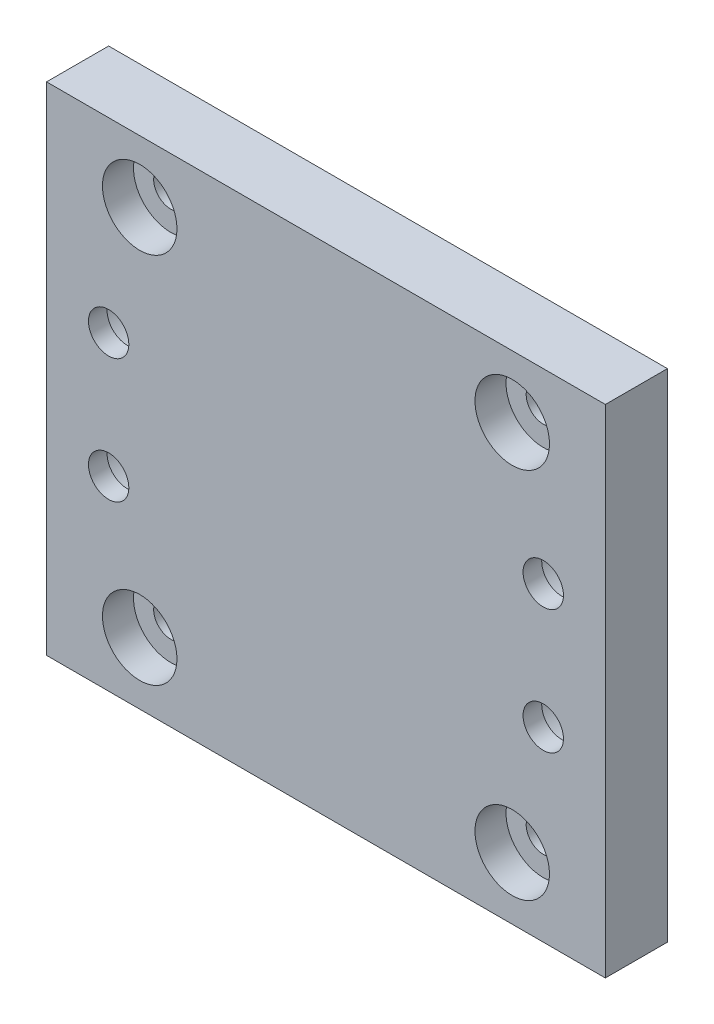
from build123d import *

# Parameters (mm, degrees)
ESQUISSE1_W             = 90
ESQUISSE1_H             = 80
ESQUISSE1_R             = 2.75
ESQUISSE1_R_2           = 3.25
BOSS_EXTRU_1_DEPTH      = 10
ESQUISSE2_R             = 6
ENL_V_MAT_EXTRU_1_DEPTH = 5
ESQUISSE4_R             = 7
ENL_V_MAT_EXTRU_2_DEPTH = 7


with BuildPart() as part:
    # Esquisse1 → Boss.-Extru.1 (new body)
    with BuildSketch(Plane.XY):
        with Locations((-2.432799292, 6.788403994)):
            Rectangle(ESQUISSE1_W, ESQUISSE1_H)
        with Locations((-32.432799292, 36.788403994)):
            Circle(ESQUISSE1_R, mode=Mode.SUBTRACT)
        with Locations((27.567200708, 36.788403994)):
            Circle(ESQUISSE1_R, mode=Mode.SUBTRACT)
        with Locations((27.567200708, -23.211596006)):
            Circle(ESQUISSE1_R, mode=Mode.SUBTRACT)
        with Locations((-32.432799292, -23.211596006)):
            Circle(ESQUISSE1_R, mode=Mode.SUBTRACT)
        with Locations((-37.432799292, 16.788403994)):
            Circle(ESQUISSE1_R_2, mode=Mode.SUBTRACT)
        with Locations((-37.432799292, -3.211596006)):
            Circle(ESQUISSE1_R_2, mode=Mode.SUBTRACT)
        with Locations((32.567200708, 16.788403994)):
            Circle(ESQUISSE1_R_2, mode=Mode.SUBTRACT)
        with Locations((32.567200708, -3.211596006)):
            Circle(ESQUISSE1_R_2, mode=Mode.SUBTRACT)
    extrude(amount=BOSS_EXTRU_1_DEPTH)

    # Esquisse2 → Enlèv. mat.-Extru.1 (cut)
    with BuildSketch(Plane.XY.offset(10)):
        with Locations((-32.432799292, 36.788403994)):
            Circle(ESQUISSE2_R)
        with Locations((27.567200708, 36.788403994)):
            Circle(ESQUISSE2_R)
        with Locations((27.567200708, -23.211596006)):
            Circle(ESQUISSE2_R)
        with Locations((-32.432799292, -23.211596006)):
            Circle(ESQUISSE2_R)
    extrude(amount=-ENL_V_MAT_EXTRU_1_DEPTH, mode=Mode.SUBTRACT)

    # Esquisse4 → Enlèv. mat.-Extru.2 (cut)
    with BuildSketch(Plane(origin=(0, 0, 0), x_dir=(-1, 0, 0), z_dir=(0, 0, -1))):
        with Locations((-32.567200708, 16.788403994)):
            Circle(ESQUISSE4_R)
        with Locations((37.432799292, 16.788403994)):
            Circle(ESQUISSE4_R)
        with Locations((37.432799292, -3.211596006)):
            Circle(ESQUISSE4_R)
        with Locations((-32.567200708, -3.211596006)):
            Circle(ESQUISSE4_R)
    extrude(amount=-ENL_V_MAT_EXTRU_2_DEPTH, mode=Mode.SUBTRACT)


solid = part.part
